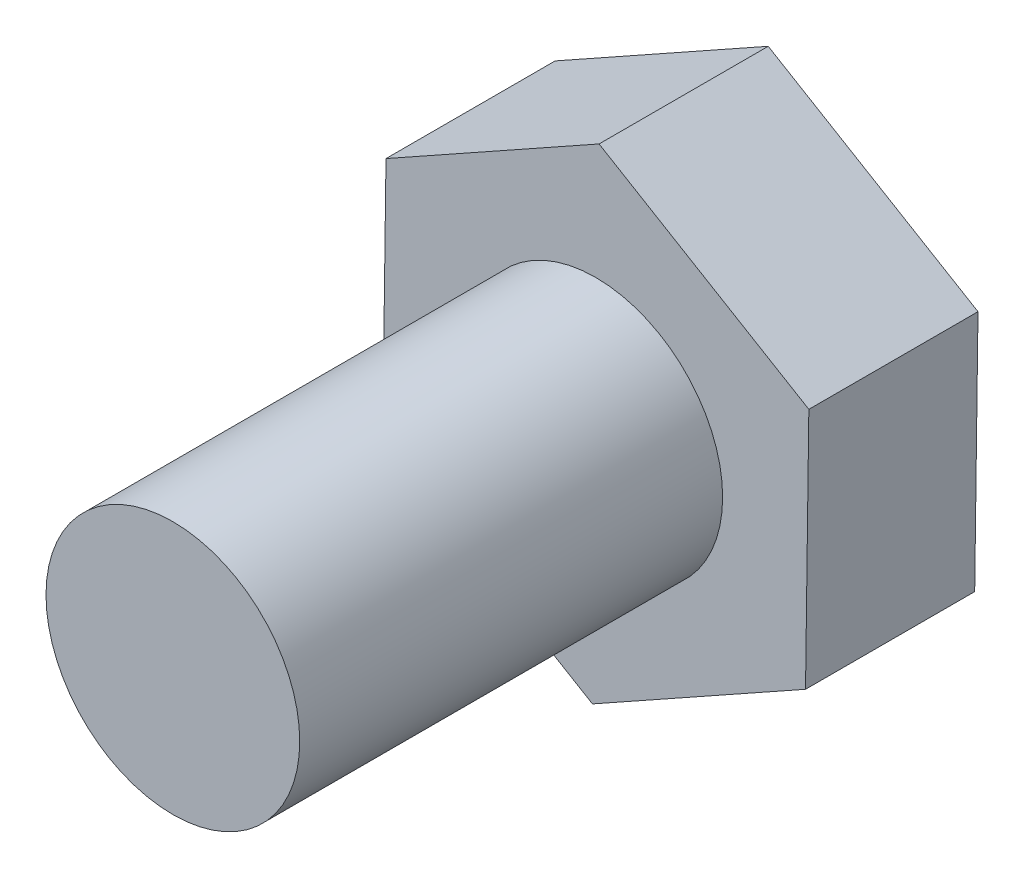
from build123d import *

# Parameters (mm, degrees)
EXTRUDE_1_DEPTH = 4
SKETCH_2_R      = 3
EXTRUDE_2_DEPTH = 10


with BuildPart() as part:
    # Эскиз1 → Бобышка-Вытянуть1 (new body)
    with BuildSketch(Plane.XY):
        Polygon((4.960366257, -2.954335785), (5.03871297, 2.818635298), (0.078346713, 5.772971083), (-4.960366257, 2.954335785), (-5.03871297, -2.818635298), (-0.078346713, -5.772971083), align=None)
    extrude(amount=EXTRUDE_1_DEPTH)

    # Эскиз2 → Бобышка-Вытянуть2 (add)
    with BuildSketch(Plane.XY.offset(4)):
        Circle(SKETCH_2_R)
    extrude(amount=EXTRUDE_2_DEPTH)


solid = part.part
